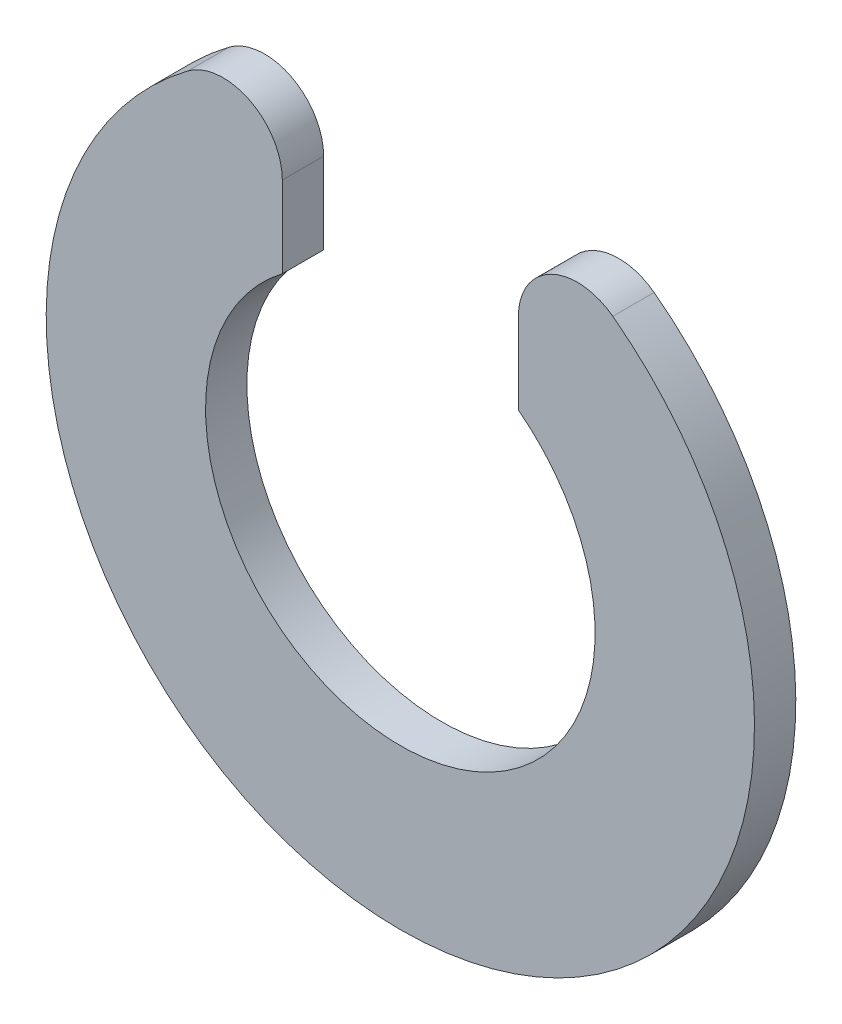
from build123d import *

# Parameters (mm, degrees)
SKETCH1_R           = 6
SKETCH1_R_2         = 3.3
BOSS_EXTRUDE1_DEPTH = 0.7
CUT_EXTRUDE1_DEPTH  = 0.7
FILLET1_R           = 1


with BuildPart() as part:
    # Sketch1 → Boss-Extrude1 (new body)
    with BuildSketch(Plane.XY):
        Circle(SKETCH1_R)
        Circle(SKETCH1_R_2, mode=Mode.SUBTRACT)
    extrude(amount=BOSS_EXTRUDE1_DEPTH)

    # Sketch2 → Cut-Extrude1 (cut)
    with BuildSketch(Plane.XY.offset(0.7)):
        with BuildLine():
            Line((-2, 5.656854249), (-2, 2.62488095))
            Line((-2, 2.62488095), (2, 2.62488095))
            Line((2, 2.62488095), (2, 5.656854249))
            ThreePointArc((2, 5.656854249), (0, 7.656854249), (-2, 5.656854249))
        make_face()
    extrude(amount=-CUT_EXTRUDE1_DEPTH, mode=Mode.SUBTRACT)

    # Fillet1
    fillet1_edges = [part.edges().sort_by_distance(p)[0] for p in [
        (-2, 5.656854249, 0.35),
        (2, 5.656854249, 0.35),
    ]]
    fillet(fillet1_edges, radius=FILLET1_R)


solid = part.part
